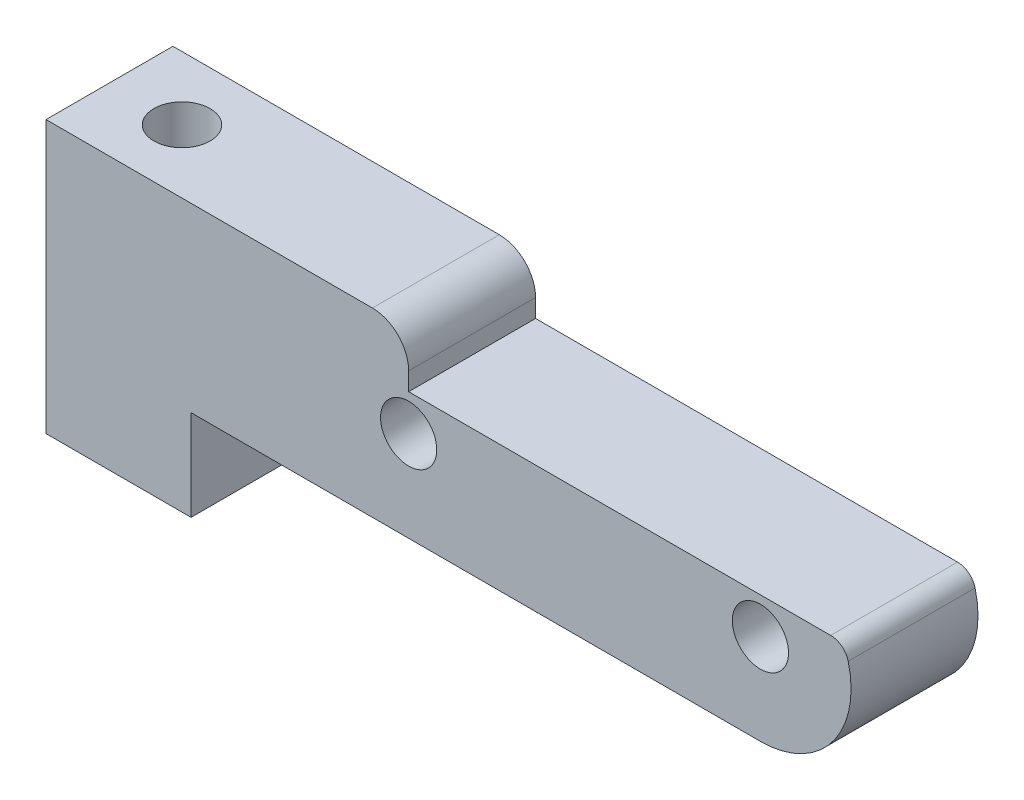
from build123d import *

# Parameters (mm, degrees)
CROQUIS1_R              = 1.55
SALIENTE_EXTRUIR1_DEPTH = 7
REDONDEO1_R             = 1
REDONDEO2_R             = 2
CROQUIS2_R              = 1.55
CORTAR_EXTRUIR1_DEPTH   = 33.110590153
CROQUIS3_W              = 8
CROQUIS3_H              = 7
CROQUIS3_R              = 1.55
SALIENTE_EXTRUIR2_DEPTH = 5


with BuildPart() as part:
    # Croquis1 → Saliente-Extruir1 (new body)
    # profile 1 of 3: a face of its own
    with BuildSketch(Plane.XY):
        with BuildLine():
            ThreePointArc((-9.7, 5), (-14.7, 0), (-9.7, -5))
            Line((-9.7, -5), (-29.7, -5))
            Line((-29.7, -5), (-29.7, 5))
            Line((-29.7, 5), (-9.7, 5))
        make_face()
    # profile 2 of 3: a face of its own
    with BuildSketch(Plane.XY):
        with BuildLine():
            Line((14.282575695, 2), (-9.7, 2))
            Line((-9.7, 2), (-14.282575695, 2))
            ThreePointArc((-14.282575695, 2), (-13.883300133, -2.738612788), (-9.7, -5))
            Line((-9.7, -5), (9.7, -5))
            ThreePointArc((9.7, -5), (13.883300133, -2.738612788), (14.282575695, 2))
        make_face()
        with Locations((-9.7, 0)):
            Circle(CROQUIS1_R, mode=Mode.SUBTRACT)
        with Locations((9.7, 0)):
            Circle(CROQUIS1_R, mode=Mode.SUBTRACT)
    # profile 3 of 3: a face of its own
    with BuildSketch(Plane.XY):
        with BuildLine():
            Line((-9.7, 2), (-9.7, 5))
            ThreePointArc((-9.7, 5), (-12.438612788, 4.183300133), (-14.282575695, 2))
            Line((-14.282575695, 2), (-9.7, 2))
        make_face()
    extrude(amount=SALIENTE_EXTRUIR1_DEPTH)

    # Redondeo1
    redondeo1_edges = [part.edges().sort_by_distance(p)[0] for p in [
        (14.282575695, 2, 3.5),
    ]]
    fillet(redondeo1_edges, radius=REDONDEO1_R)

    # Redondeo2
    redondeo2_edges = [part.edges().sort_by_distance(p)[0] for p in [
        (-9.7, 5, 3.5),
    ]]
    fillet(redondeo2_edges, radius=REDONDEO2_R)

    # Croquis2 → Cortar-Extruir1 (cut, through all)
    with BuildSketch(Plane(origin=(0, 5, 0), x_dir=(1, 0, 0), z_dir=(0, 1, 0))):
        with Locations(Location((-25.7, -3.5, 0), (0, 0, 180))):
            Circle(CROQUIS2_R)
    extrude(amount=-CORTAR_EXTRUIR1_DEPTH, mode=Mode.SUBTRACT)

    # Croquis3 → Saliente-Extruir2 (add)
    with BuildSketch(Plane.XZ.offset(5)):
        with Locations((-25.7, 3.5)):
            Rectangle(CROQUIS3_W, CROQUIS3_H)
        with Locations(Location((-25.7, 3.5, 0), (0, 0, 180))):
            Circle(CROQUIS3_R, mode=Mode.SUBTRACT)
    extrude(amount=SALIENTE_EXTRUIR2_DEPTH)


solid = part.part
